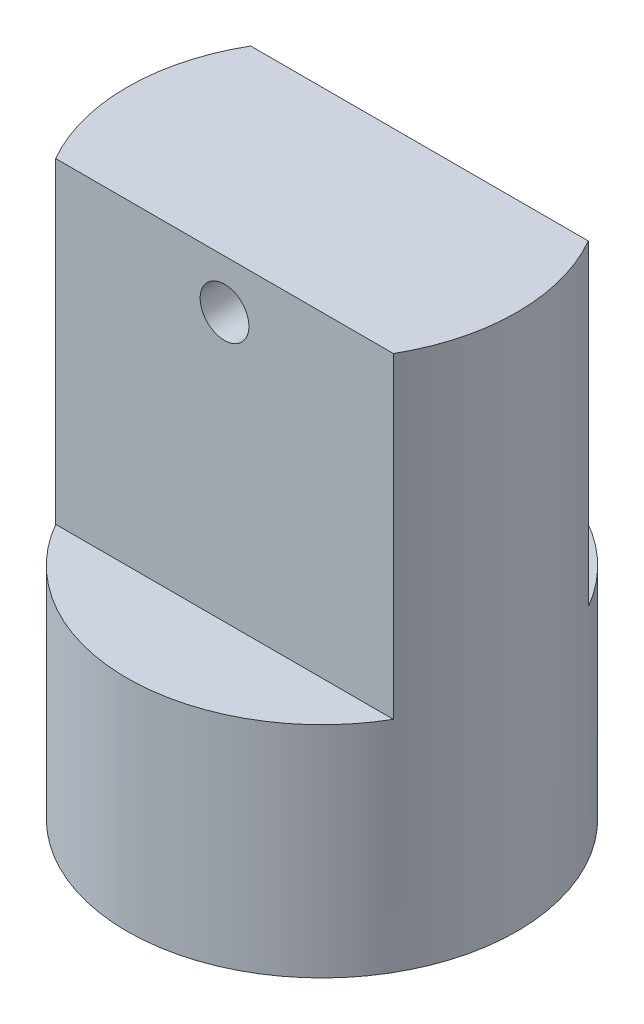
from build123d import *

# Parameters (mm, degrees)
SKETCH1_R           = 50.8
BOSS_EXTRUDE1_DEPTH = 139.7
CUT_EXTRUDE1_START  = 25.4
SKETCH2_W           = 101.6
SKETCH2_H           = 165.1
CUT_EXTRUDE1_DEPTH  = 50.8
CUT_EXTRUDE2_START  = -25.4
SKETCH2_2_W         = 101.6
SKETCH2_2_H         = 165.1
CUT_EXTRUDE2_DEPTH  = 50.8
SKETCH3_R           = 6.35
CUT_EXTRUDE3_DEPTH  = 25.4
SKETCH4_R           = 6.35
CUT_EXTRUDE4_DEPTH  = 168.042419762


with BuildPart() as part:
    # Sketch1 → Boss-Extrude1 (new body)
    with BuildSketch(Plane(origin=(0, 0, 0), x_dir=(1, 0, 0), z_dir=(0, 1, 0))):
        Circle(SKETCH1_R)
    extrude(amount=BOSS_EXTRUDE1_DEPTH)

    # Sketch2 → Cut-Extrude1 (cut)
    with BuildSketch(Plane.XY.offset(CUT_EXTRUDE1_START)):
        with Locations((0, 139.7)):
            Rectangle(SKETCH2_W, SKETCH2_H)
    extrude(amount=CUT_EXTRUDE1_DEPTH, mode=Mode.SUBTRACT)

    # Sketch2<2> → Cut-Extrude2 (cut)
    with BuildSketch(Plane.XY.offset(CUT_EXTRUDE2_START)):
        with Locations((0, 139.7)):
            Rectangle(SKETCH2_2_W, SKETCH2_2_H)
    extrude(amount=-CUT_EXTRUDE2_DEPTH, mode=Mode.SUBTRACT)

    # Sketch3 → Cut-Extrude3 (cut)
    with BuildSketch(Plane.XZ):
        Circle(SKETCH3_R)
    extrude(amount=-CUT_EXTRUDE3_DEPTH, mode=Mode.SUBTRACT)

    # Sketch4 → Cut-Extrude4 (cut, through all)
    with BuildSketch(Plane.XY.offset(25.4)):
        with Locations((0, 127)):
            Circle(SKETCH4_R)
    extrude(amount=-CUT_EXTRUDE4_DEPTH, mode=Mode.SUBTRACT)


solid = part.part
